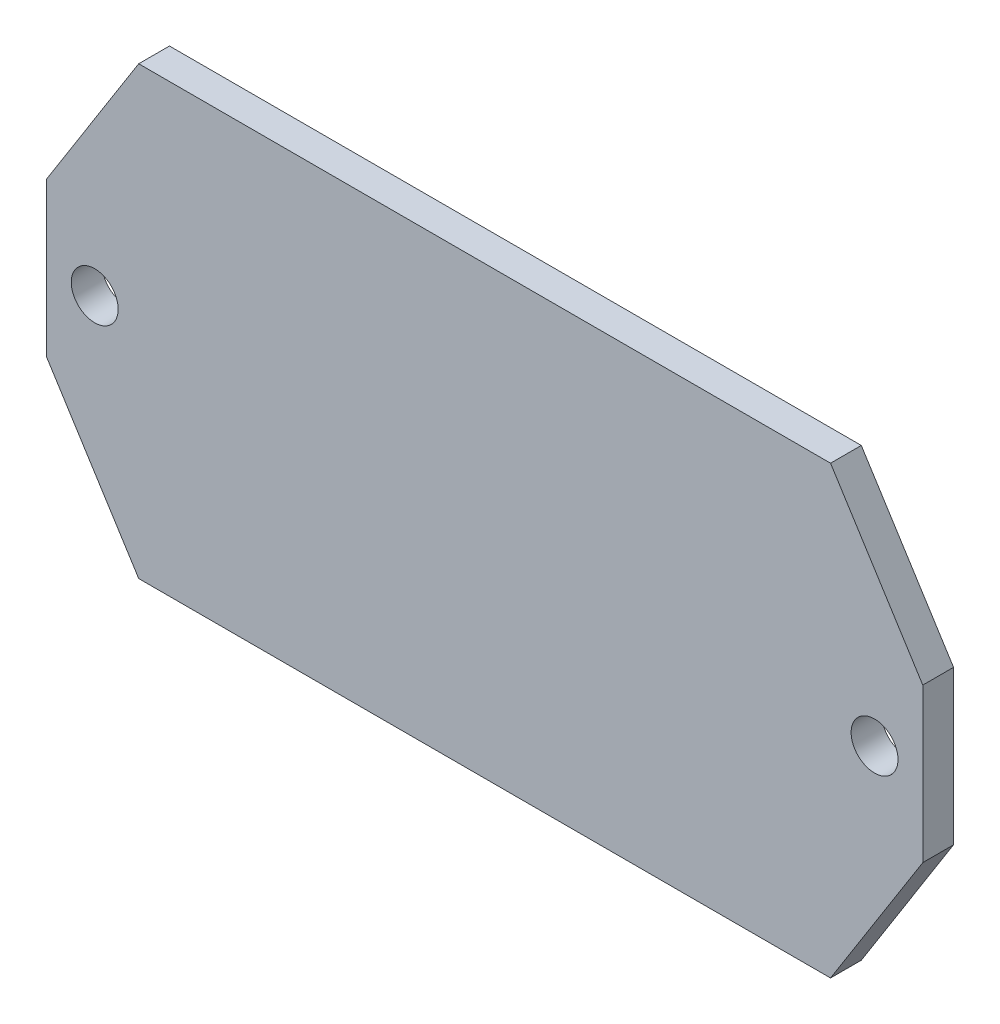
from build123d import *

# Parameters (mm, degrees)
SKETCH_1_W          = 57
SKETCH_1_H          = 29
EXTRUDE_1_DEPTH     = 2
CUT_EXTRUDE_1_DEPTH = 2
SKETCH_3_R          = 1.525
CUT_EXTRUDE_2_DEPTH = 2


with BuildPart() as part:
    # 草图1 → 凸台-拉伸1 (new body)
    with BuildSketch(Plane.XY):
        Rectangle(SKETCH_1_W, SKETCH_1_H)
    extrude(amount=EXTRUDE_1_DEPTH)

    # 草图2 → 切除-拉伸1 (cut)
    with BuildSketch(Plane.XY.offset(2)):
        Polygon((22.5, 14.5), (28.5, 5), (28.5, 14.5), align=None)
        Polygon((28.5, -14.5), (22.5, -14.5), (28.5, -5), align=None)
    cut_extrude_1 = extrude(amount=-CUT_EXTRUDE_1_DEPTH, mode=Mode.SUBTRACT)

    # 镜向1: 切除-拉伸1 across plane
    add(cut_extrude_1.mirror(Plane(origin=(0, 0, 0), x_dir=(0, 0, 1), z_dir=(1, 0, 0))), mode=Mode.SUBTRACT)

    # 草图3 → 切除-拉伸2 (cut)
    with BuildSketch(Plane.XY.offset(2)):
        with Locations((25.362669783, 0)):
            Circle(SKETCH_3_R)
        with Locations(Location((-25.362669783, 0, 0), (0, 0, 180))):
            Circle(SKETCH_3_R)
    extrude(amount=-CUT_EXTRUDE_2_DEPTH, mode=Mode.SUBTRACT)


solid = part.part
